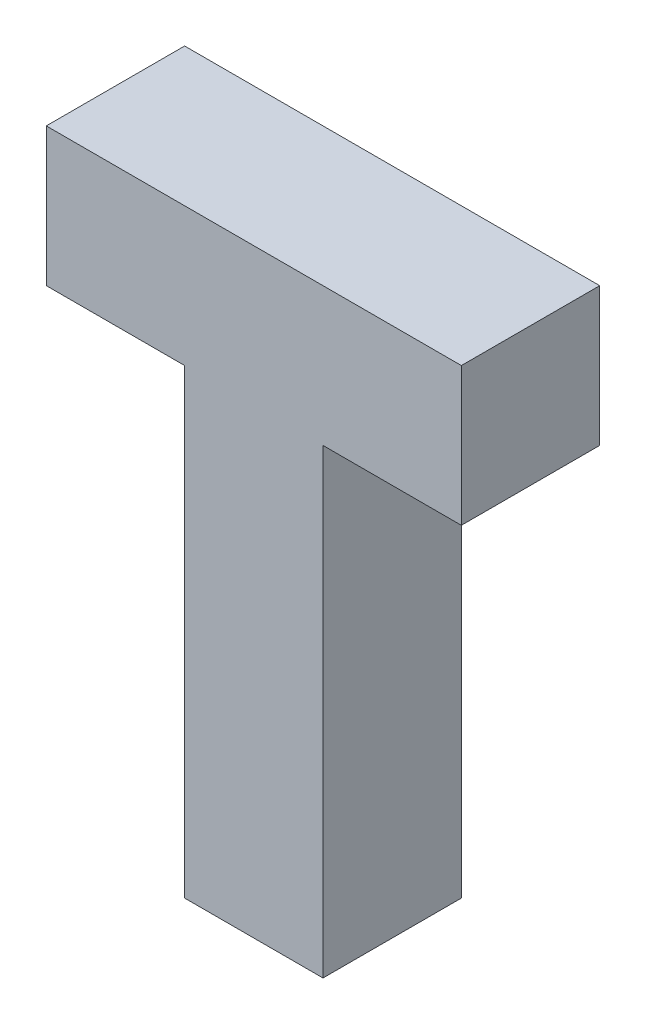
from build123d import *

# Parameters (mm, degrees)
BOSS_EXTRUDE1_DEPTH = 3


with BuildPart() as part:
    # Sketch1 → Boss-Extrude1 (new body)
    with BuildSketch(Plane.XY):
        Polygon((-2.20482831, 6.361669004), (-2.20482831, 3.361669004), (0.79517169, 3.361669004), (0.79517169, -6.638330996), (3.79517169, -6.638330996), (3.79517169, 3.361669004), (6.79517169, 3.361669004), (6.79517169, 6.361669004), align=None)
    extrude(amount=BOSS_EXTRUDE1_DEPTH)


solid = part.part
